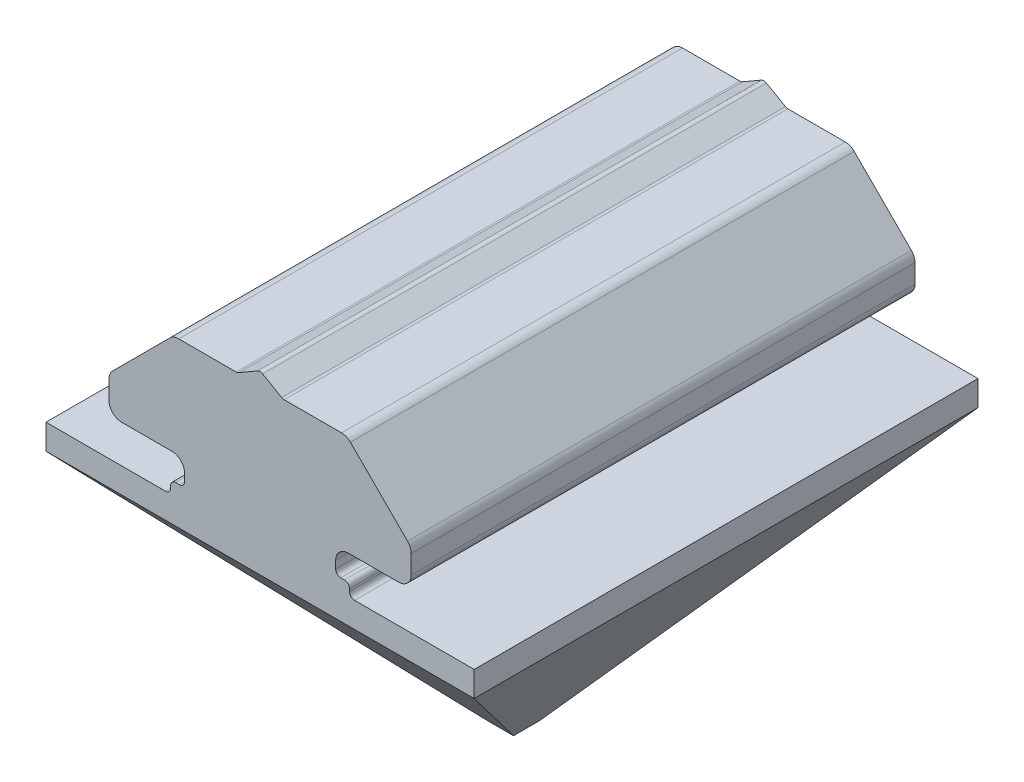
from build123d import *

# Parameters (mm, degrees)
BOSS_EXTRUDE1_DEPTH = 20


with BuildPart() as part:
    # Sketch3 → Boss-Extrude1 (new body)
    with BuildSketch(Plane.XY):
        with BuildLine():
            Line((3.750000228, -10), (8.5, -10))
            Line((8.5, -10), (8.5, -11))
            Line((8.5, -11), (-8.5, -11))
            Line((-8.5, -11), (-8.5, -10))
            Line((-8.5, -10), (-3.750000228, -10))
            ThreePointArc((-3.750000228, -10), (-3.608578871, -9.941421356), (-3.550000228, -9.8))
            Line((-3.550000228, -9.8), (-3.550000228, -9.7))
            ThreePointArc((-3.550000228, -9.7), (-3.491421584, -9.558578644), (-3.350000228, -9.5))
            Line((-3.350000228, -9.5), (-3.2, -9.5))
            ThreePointArc((-3.2, -9.5), (-3.058578644, -9.441421356), (-3, -9.3))
            Line((-3, -9.3), (-3, -8.999999673))
            ThreePointArc((-3, -8.999999673), (-3.146446609, -8.646446283), (-3.5, -8.499999673))
            Line((-3.5, -8.499999673), (-5.500000686, -8.499999673))
            ThreePointArc((-5.500000686, -8.499999673), (-5.853554077, -8.353553064), (-6.000000686, -7.999999673))
            Line((-6.000000686, -7.999999673), (-6.000000686, -7.267766626))
            ThreePointArc((-6.000000686, -7.267766626), (-5.961940448, -7.076424899), (-5.853554059, -6.914213219))
            Line((-5.853554059, -6.914213219), (-3.585787212, -4.646446592))
            ThreePointArc((-3.585787212, -4.646446592), (-3.423575544, -4.538060229), (-3.232233839, -4.5))
            Line((-3.232233839, -4.5), (-0.953590312, -4.5))
            ThreePointArc((-0.953590312, -4.5), (-0.901826505, -4.493185166), (-0.853590316, -4.473205083))
            Line((-0.853590316, -4.473205083), (-0.100000045, -4.038119562))
            ThreePointArc((-0.100000045, -4.038119562), (0, -4.011324632), (0.100000045, -4.038119562))
            Line((0.100000045, -4.038119562), (0.853590316, -4.473205083))
            ThreePointArc((0.853590316, -4.473205083), (0.901826505, -4.493185166), (0.953590312, -4.5))
            Line((0.953590312, -4.5), (3.232233839, -4.5))
            ThreePointArc((3.232233839, -4.5), (3.423575544, -4.538060229), (3.585787212, -4.646446592))
            Line((3.585787212, -4.646446592), (5.853554059, -6.914213219))
            ThreePointArc((5.853554059, -6.914213219), (5.961940448, -7.076424899), (6.000000686, -7.267766626))
            Line((6.000000686, -7.267766626), (6.000000686, -7.999999673))
            ThreePointArc((6.000000686, -7.999999673), (5.853554077, -8.353553064), (5.500000686, -8.499999673))
            Line((5.500000686, -8.499999673), (3.5, -8.499999673))
            ThreePointArc((3.5, -8.499999673), (3.146446609, -8.646446283), (3, -8.999999673))
            Line((3, -8.999999673), (3, -9.3))
            ThreePointArc((3, -9.3), (3.058578644, -9.441421356), (3.2, -9.5))
            Line((3.2, -9.5), (3.350000228, -9.5))
            ThreePointArc((3.350000228, -9.5), (3.491421584, -9.558578644), (3.550000228, -9.7))
            Line((3.550000228, -9.7), (3.550000228, -9.8))
            ThreePointArc((3.550000228, -9.8), (3.608578871, -9.941421356), (3.750000228, -10))
        make_face()
    extrude(amount=BOSS_EXTRUDE1_DEPTH)

    # Çizim2 → section 0 of loft1
    with BuildSketch(Plane(origin=(0, -21, 0), x_dir=(-1, 0, 0), z_dir=(0, -1, 0)), mode=Mode.PRIVATE) as loft1_s0:
        with BuildLine():
            Line((-0.560549313, -9.5), (0.439450687, -9.5))
            Line((0.439450687, -9.5), (0.439450687, -10.5))
            Line((0.439450687, -10.5), (-0.560549313, -10.5))
            Line((-0.560549313, -10.5), (-0.560549313, -9.5))
        make_face()
    # loft up to a face of the part (loft1)
    loft([loft1_s0.sketch, part.faces().sort_by_distance((0, -11, 10))[0]])


solid = part.part
